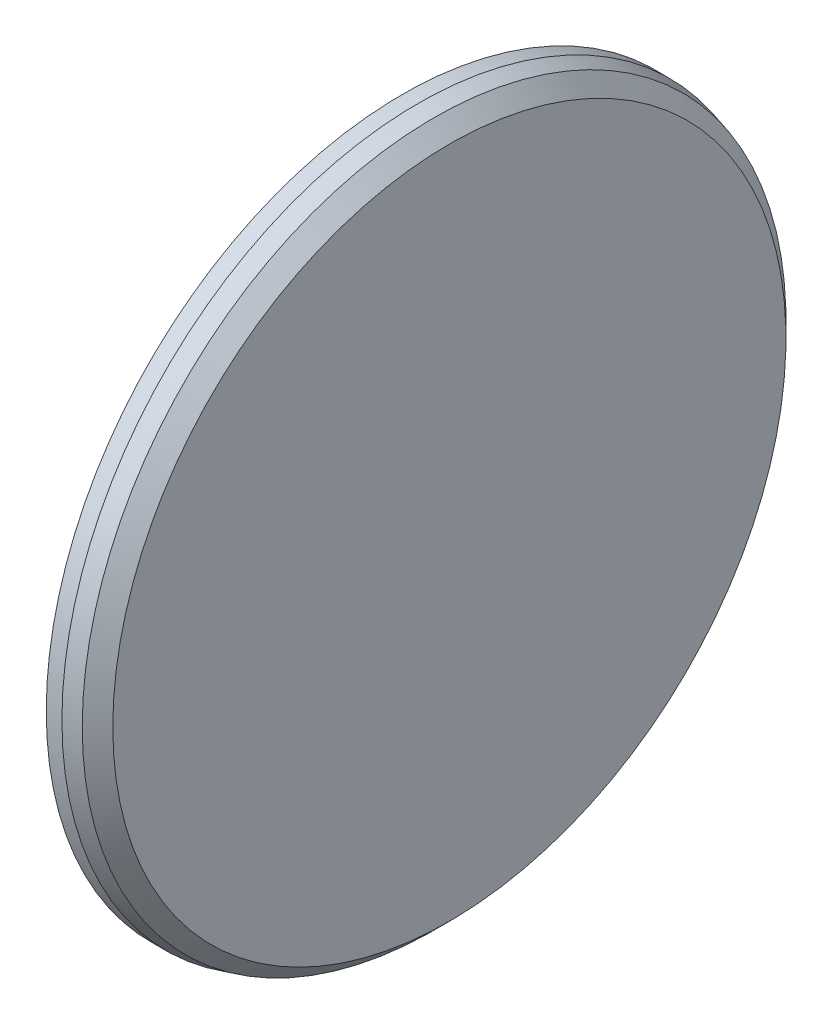
from build123d import *

# Parameters (mm, degrees)
BOSS_EXTRU_1_DEPTH           = 20
R_P_TITION_CIRCULAIRE1_COUNT = 9


with BuildPart() as part:
    # Esquisse1 → Révolution1 (revolve)
    with BuildSketch(Plane.XY, mode=Mode.PRIVATE) as r_volution1_sk:
        Polygon((0, 0), (0, 430), (-19.509618943, 449.509618943), (-40, 455), (-60, 455), (-60, 410), (-30, 410), (-30, 100), (-80, 100), (-80, 0), align=None)
    revolve(r_volution1_sk.sketch.rotate(Axis((-80, 0, 0), (1, 0, 0)), 90), axis=Axis((-80, 0, 0), (1, 0, 0)))

    # Esquisse2 → Boss.-Extru.1 (add)
    with BuildSketch(Plane.ZY.offset(30)):
        with BuildLine():
            Line((-20, 104.612235173), (-20, 350.590090575))
            ThreePointArc((-20, 350.590090575), (-30.106477192, 383.916302208), (-57.021212726, 406.015493915))
            ThreePointArc((-57.021212726, 406.015493915), (-15.546179109, 409.705157784), (26.089198597, 409.169101615))
            ThreePointArc((26.089198597, 409.169101615), (21.660095503, 405.483324106), (20, 399.965535329))
            Line((20, 399.965535329), (20, 103.482062221))
            ThreePointArc((20, 103.482062221), (20.497231695, 100.367998231), (21.939478907, 97.563616504))
            ThreePointArc((21.939478907, 97.563616504), (-0.653338085, 99.997865724), (-23.212419248, 97.268615661))
            ThreePointArc((-23.212419248, 97.268615661), (-20.838236864, 100.60448066), (-20, 104.612235173))
        make_face()
    boss_extru_1 = extrude(amount=BOSS_EXTRU_1_DEPTH)

    # Répétition circulaire1: Boss.-Extru.1 ×9 about axis
    r_p_tition_circulaire1_axis = Axis((0, 0, 0), (1, 0, 0))
    for i in range(1, R_P_TITION_CIRCULAIRE1_COUNT):
        add(boss_extru_1.rotate(r_p_tition_circulaire1_axis, i * 360 / R_P_TITION_CIRCULAIRE1_COUNT))


solid = part.part
